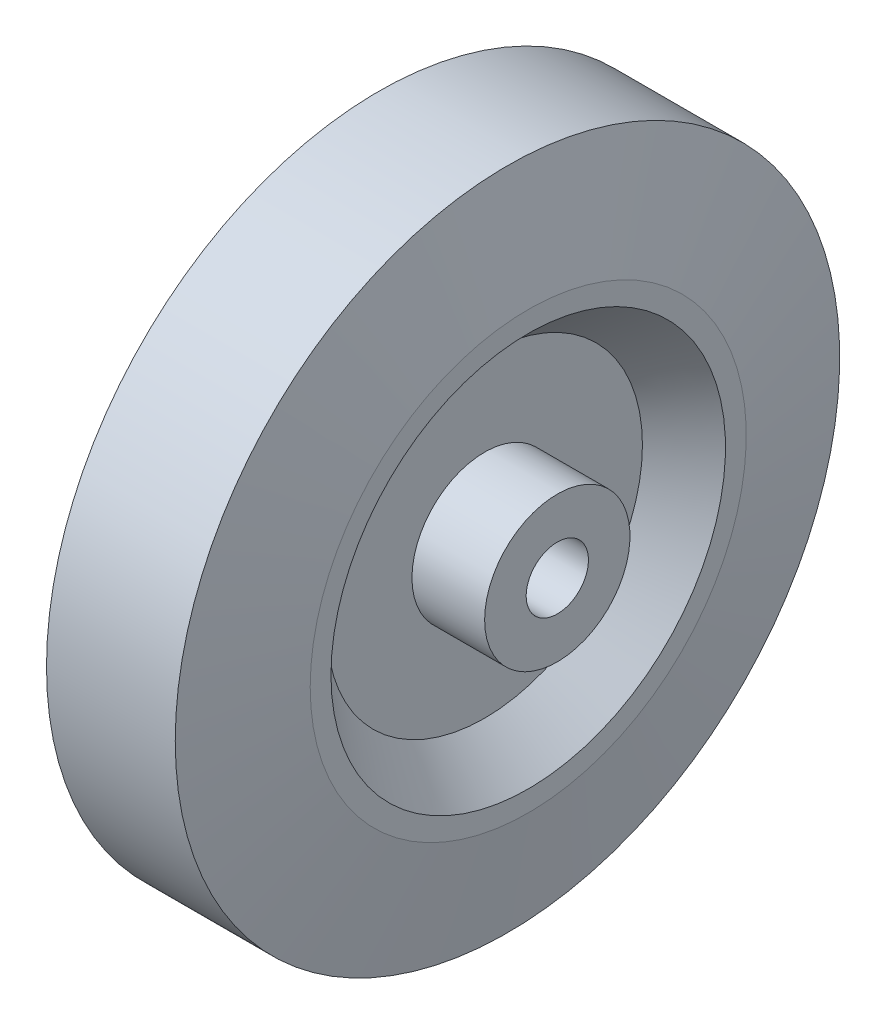
from build123d import *


with BuildPart() as part:
    # Croquis1 → Revolución1 (revolve)
    with BuildSketch(Plane.XY, mode=Mode.PRIVATE) as revoluci_n1_sk:
        Polygon((-15.5, 80), (15.5, 80), (20.5, 52.5), (20.5, 47.5), (10, 38), (10, 17.5), (27.5, 17.5), (27.5, 7.5), (-27.5, 7.5), (-27.5, 17.5), (-10, 17.5), (-10, 38), (-20.5, 47.5), (-20.5, 52.5), align=None)
    revolve(revoluci_n1_sk.sketch.rotate(Axis((-30.788195212, 0, 0), (1, 0, 0)), 90), axis=Axis((-30.788195212, 0, 0), (1, 0, 0)))


solid = part.part
